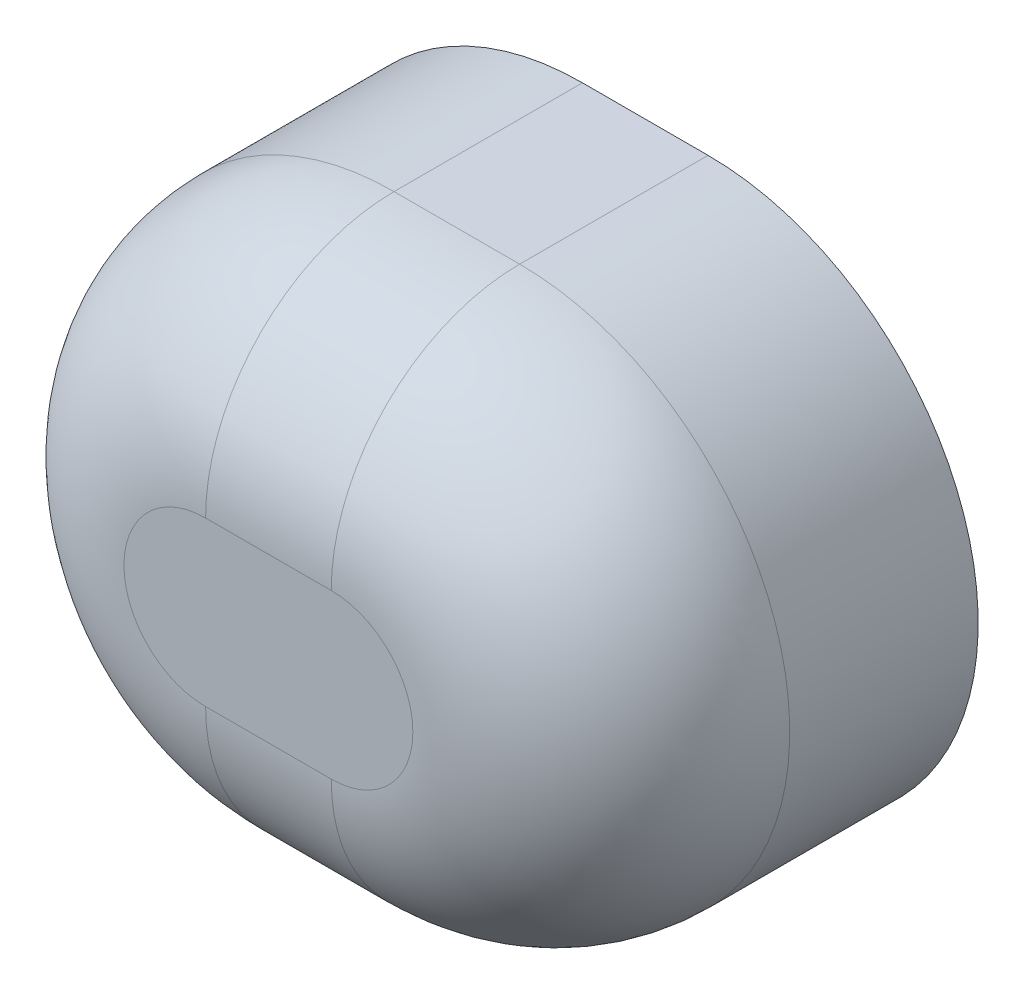
from build123d import *

# Parameters (mm, degrees)
DODANIE_WYCI_GNI_CIE2_DEPTH = 3
ZAOKR_GLENIE3_R             = 1.5


with BuildPart() as part:
    # Szkic2 → Dodanie-wyciągnięcie2 (new body)
    with BuildSketch(Plane.XY):
        with BuildLine():
            Line((-5.24547374, 2.15), (-4.24547374, 2.15))
            ThreePointArc((-4.24547374, 2.15), (-2.09547374, 0), (-4.24547374, -2.15))
            Line((-4.24547374, -2.15), (-5.24547374, -2.15))
            ThreePointArc((-5.24547374, -2.15), (-7.39547374, 0), (-5.24547374, 2.15))
        make_face()
    extrude(amount=DODANIE_WYCI_GNI_CIE2_DEPTH)

    # Zaokrąglenie3
    zaokr_glenie3_edges = [part.edges().sort_by_distance(p)[0] for p in [
        (-2.09547374, 0, 3),
        (-4.74547374, 2.15, 3),
        (-7.39547374, 0, 3),
        (-4.74547374, -2.15, 3),
    ]]
    fillet(zaokr_glenie3_edges, radius=ZAOKR_GLENIE3_R)


solid = part.part
